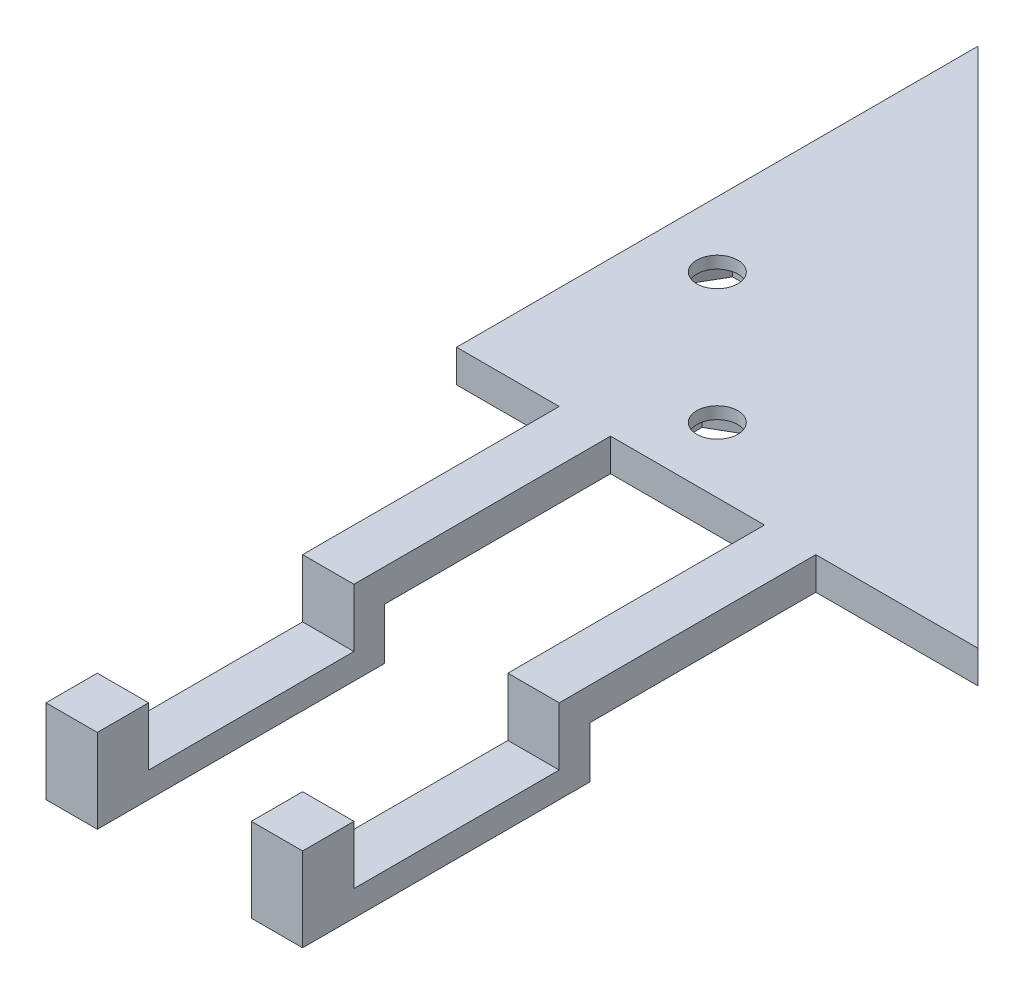
from build123d import *

# Parameters (mm, degrees)
BOSS_EXTRUDE1_DEPTH = 3.175
SKETCH2_R           = 2
CUT_EXTRUDE1_DEPTH  = 72.912172996
CUT_EXTRUDE2_START  = -3.175
CUT_EXTRUDE2_DEPTH  = 2
BOSS_EXTRUDE2_START = 10
BOSS_EXTRUDE2_DEPTH = 5
BOSS_EXTRUDE3_START = 30
BOSS_EXTRUDE3_DEPTH = 5


with BuildPart() as part:
    # Sketch1 → Boss-Extrude1 (new body)
    with BuildSketch(Plane(origin=(0, 0, 0), x_dir=(1, 0, 0), z_dir=(0, 1, 0))):
        Polygon((0, 0), (50.8, 0), (0, 50.8), align=None)
    extrude(amount=BOSS_EXTRUDE1_DEPTH)

    # Sketch2 → Cut-Extrude1 (cut, through all)
    with BuildSketch(Plane(origin=(0, 3.175, 0), x_dir=(1, 0, 0), z_dir=(0, 1, 0))):
        with Locations(Location((19.05, 6.35, 0), (0, 0, 270))):
            Circle(SKETCH2_R)
        with Locations(Location((6.35, 19.05, 0), (0, 0, 90))):
            Circle(SKETCH2_R)
    extrude(amount=-CUT_EXTRUDE1_DEPTH, mode=Mode.SUBTRACT)

    # Sketch3 → Cut-Extrude2 (cut)
    with BuildSketch(Plane(origin=(0, 3.175, 0), x_dir=(1, 0, 0), z_dir=(0, 1, 0)).offset(CUT_EXTRUDE2_START)):
        Polygon((8.370723055, 15.550005), (10.391446111, 19.05), (8.370723055, 22.549995), (4.329276945, 22.549995), (2.308553889, 19.05), (4.329276945, 15.550005), align=None)
        Polygon((22.549995, 4.329276945), (19.05, 2.308553889), (15.550005, 4.329276945), (15.550005, 8.370723055), (19.05, 10.391446111), (22.549995, 8.370723055), align=None)
    extrude(amount=CUT_EXTRUDE2_DEPTH, mode=Mode.SUBTRACT)

    # Sketch5 → Boss-Extrude2 (add)
    with BuildSketch(Plane(origin=(0, 0, 0), x_dir=(0, 0, -1), z_dir=(1, 0, 0)).offset(BOSS_EXTRUDE2_START)):
        Polygon((0, 0), (0, 3.175), (-25, 3.175), (-25, -2.5), (-45, -2.5), (-45, 3.175), (-50, 3.175), (-50, -5), (-22, -5), (-22, 0), align=None)
    extrude(amount=BOSS_EXTRUDE2_DEPTH)

    # Sketch5<3> → Boss-Extrude3 (add)
    with BuildSketch(Plane(origin=(0, 0, 0), x_dir=(0, 0, -1), z_dir=(1, 0, 0)).offset(BOSS_EXTRUDE3_START)):
        Polygon((0, 0), (0, 3.175), (-25, 3.175), (-25, -2.5), (-45, -2.5), (-45, 3.175), (-50, 3.175), (-50, -5), (-22, -5), (-22, 0), align=None)
    extrude(amount=BOSS_EXTRUDE3_DEPTH)


solid = part.part
